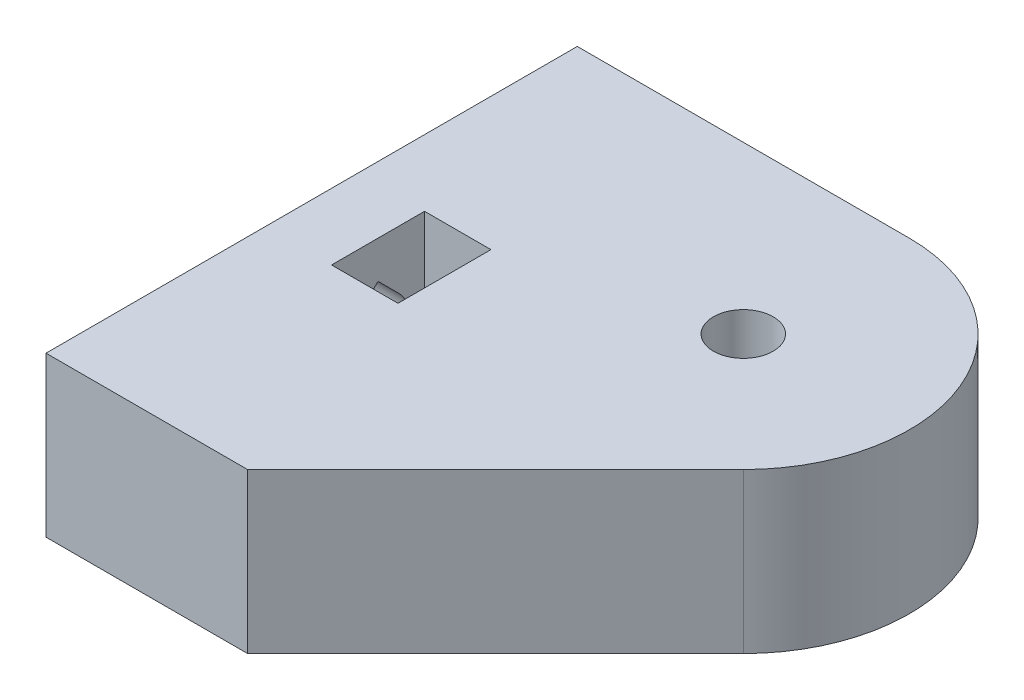
from build123d import *

# Parameters (mm, degrees)
SKETCH1_R           = 2.25
BOSS_EXTRUDE1_DEPTH = 12
CUT_EXTRUDE1_DEPTH  = 20
CUT_EXTRUDE2_REACH  = 41.054
SKETCH3_W           = 5
SKETCH3_H           = 7


with BuildPart() as part:
    # Sketch1 → Boss-Extrude1 (new body)
    with BuildSketch(Plane(origin=(0, 0, 0), x_dir=(1, 0, 0), z_dir=(0, 1, 0))):
        with BuildLine():
            Line((0, 12.5), (-15, 12.5))
            Line((-15, 12.5), (-25, 12.5))
            Line((-25, 12.5), (-25, -27.5))
            Line((-25, -27.5), (-9.82233047, -27.5))
            Line((-9.82233047, -27.5), (8.838834765, -8.838834765))
            ThreePointArc((8.838834765, -8.838834765), (11.548494156, 4.783542905), (0, 12.5))
        make_face()
        with Locations(Location((0, 0, 0), (0, 0, 270))):
            Circle(SKETCH1_R, mode=Mode.SUBTRACT)
    extrude(amount=BOSS_EXTRUDE1_DEPTH)

    # Sketch2 → Cut-Extrude1 (cut)
    with BuildSketch(Plane.ZY.offset(25)):
        with BuildLine():
            Line((5.909009742, 7.590990258), (7.5, 9.181980515))
            Line((7.5, 9.181980515), (9.090990258, 7.590990258))
            ThreePointArc((9.090990258, 7.590990258), (7.5, 3.75), (5.909009742, 7.590990258))
        make_face()
    extrude(amount=-CUT_EXTRUDE1_DEPTH, mode=Mode.SUBTRACT)

    # Sketch3 → Cut-Extrude2 (cut, up to next)
    with BuildSketch(Plane(origin=(0, 12, 0), x_dir=(1, 0, 0), z_dir=(0, 1, 0)), mode=Mode.PRIVATE) as cut_extrude2_sk1:
        with Locations((-17.5, -7.5)):
            Rectangle(SKETCH3_W, SKETCH3_H)
    cut_extrude2_tool1 = extrude(cut_extrude2_sk1.sketch, amount=-CUT_EXTRUDE2_REACH, mode=Mode.PRIVATE) & part.part
    add(cut_extrude2_tool1.solids().sort_by_distance((-17.5, 12, 7.5))[0], mode=Mode.SUBTRACT)


solid = part.part
